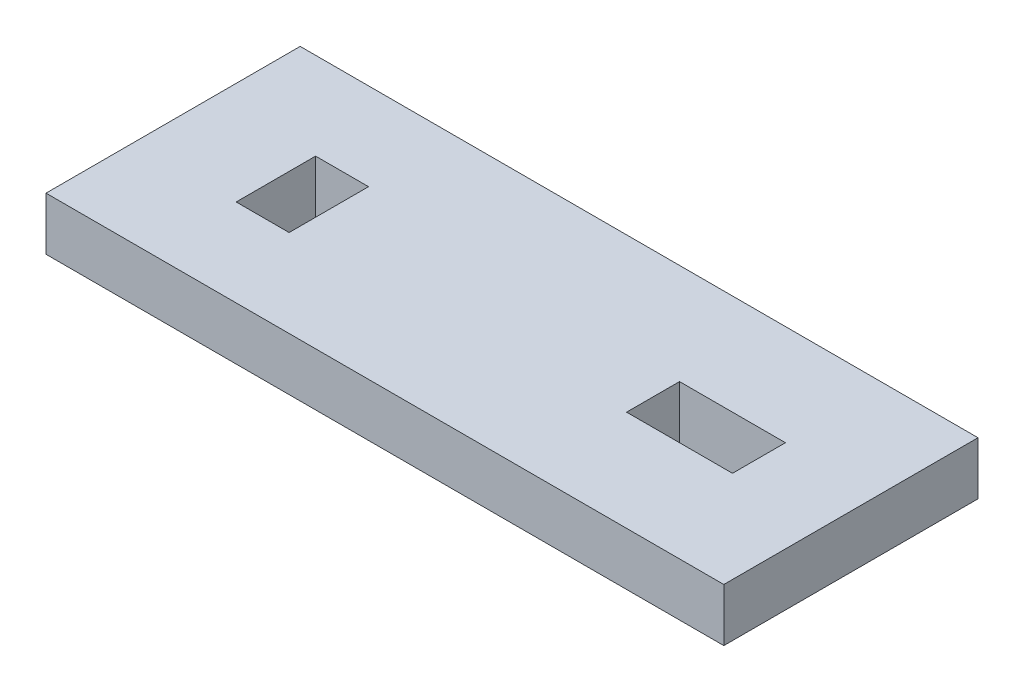
from build123d import *

# Parameters (mm, degrees)
SKETCH1_W           = 40.64
SKETCH1_H           = 15.24
BOSS_EXTRUDE1_DEPTH = 3.175
SKETCH2_W           = 6.35
SKETCH2_H           = 3.175
SKETCH2_W_2         = 3.175
SKETCH2_H_2         = 4.7625
CUT_EXTRUDE1_DEPTH  = 44.519510854


with BuildPart() as part:
    # Sketch1 → Boss-Extrude1 (new body)
    with BuildSketch(Plane(origin=(0, 0, 0), x_dir=(1, 0, 0), z_dir=(0, 1, 0))):
        with Locations((20.32, 7.62)):
            Rectangle(SKETCH1_W, SKETCH1_H)
    extrude(amount=BOSS_EXTRUDE1_DEPTH)

    # Sketch2 → Cut-Extrude1 (cut, through all)
    with BuildSketch(Plane(origin=(0, 3.175, 0), x_dir=(1, 0, 0), z_dir=(0, 1, 0))):
        with Locations((31.951971644, 7.62)):
            Rectangle(SKETCH2_W, SKETCH2_H)
        with Locations((7.747, 7.623418676)):
            Rectangle(SKETCH2_W_2, SKETCH2_H_2)
    extrude(amount=-CUT_EXTRUDE1_DEPTH, mode=Mode.SUBTRACT)


solid = part.part
